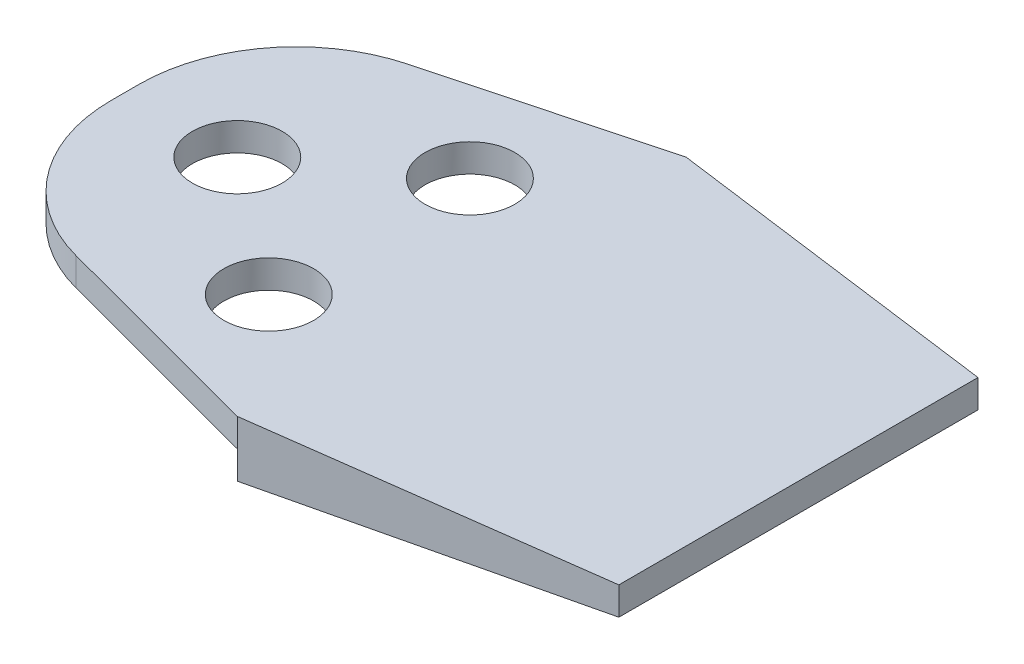
from build123d import *

# Parameters (mm, degrees)
BOSS_EXTRUDE1_DEPTH = 12.7
CUT_EXTRUDE1_DEPTH  = 25.4
CUT_EXTRUDE2_DEPTH  = 25.4
FILLET1_R           = 8.89
SKETCH4_R           = 2.54
CUT_EXTRUDE3_DEPTH  = 25.4


with BuildPart() as part:
    # Sketch1 → Boss-Extrude1 (new, symmetric)
    with BuildSketch(Plane.XY):
        Polygon((-19.05, 0), (19.05, 0), (19.05, -1.5875), (0, -3.175), (0, -1.5875), (-19.05, -1.5875), align=None)
    extrude(amount=BOSS_EXTRUDE1_DEPTH, both=True)

    # Sketch2 → Cut-Extrude1 (cut)
    with BuildSketch(Plane(origin=(0, 0, 0), x_dir=(1, 0, 0), z_dir=(0, 1, 0))):
        Polygon((0, 12.7), (19.05, 10.16), (19.05, 12.7), align=None)
    cut_extrude1 = extrude(amount=-CUT_EXTRUDE1_DEPTH, mode=Mode.SUBTRACT)

    # Mirror1: Cut-Extrude1 across plane
    add(cut_extrude1.mirror(Plane.XY), mode=Mode.SUBTRACT)

    # Sketch3 → Cut-Extrude2 (cut)
    with BuildSketch(Plane(origin=(0, 0, 0), x_dir=(1, 0, 0), z_dir=(0, 1, 0))):
        Polygon((0, 12.7), (-19.05, 7.62), (-19.05, 12.7), align=None)
    cut_extrude2 = extrude(amount=-CUT_EXTRUDE2_DEPTH, mode=Mode.SUBTRACT)

    # Mirror2: Cut-Extrude2 across plane
    add(cut_extrude2.mirror(Plane.XY), mode=Mode.SUBTRACT)

    # Fillet1
    fillet1_edges = [part.edges().sort_by_distance(p)[0] for p in [
        (-19.05, -0.79375, -7.62),
        (-19.05, -0.79375, 7.62),
    ]]
    fillet(fillet1_edges, radius=FILLET1_R)

    # Sketch4 → Cut-Extrude3 (cut)
    with BuildSketch(Plane(origin=(0, 0, 0), x_dir=(1, 0, 0), z_dir=(0, 1, 0))):
        with Locations(Location((-5.08, 5.543370255, 0), (0, 0, 270))):
            Circle(SKETCH4_R)
        with Locations(Location((-5.08, -5.837708499, 0), (0, 0, 270))):
            Circle(SKETCH4_R)
        with Locations(Location((-12.7, 0, 0), (0, 0, 270))):
            Circle(SKETCH4_R)
    extrude(amount=-CUT_EXTRUDE3_DEPTH, mode=Mode.SUBTRACT)


solid = part.part
